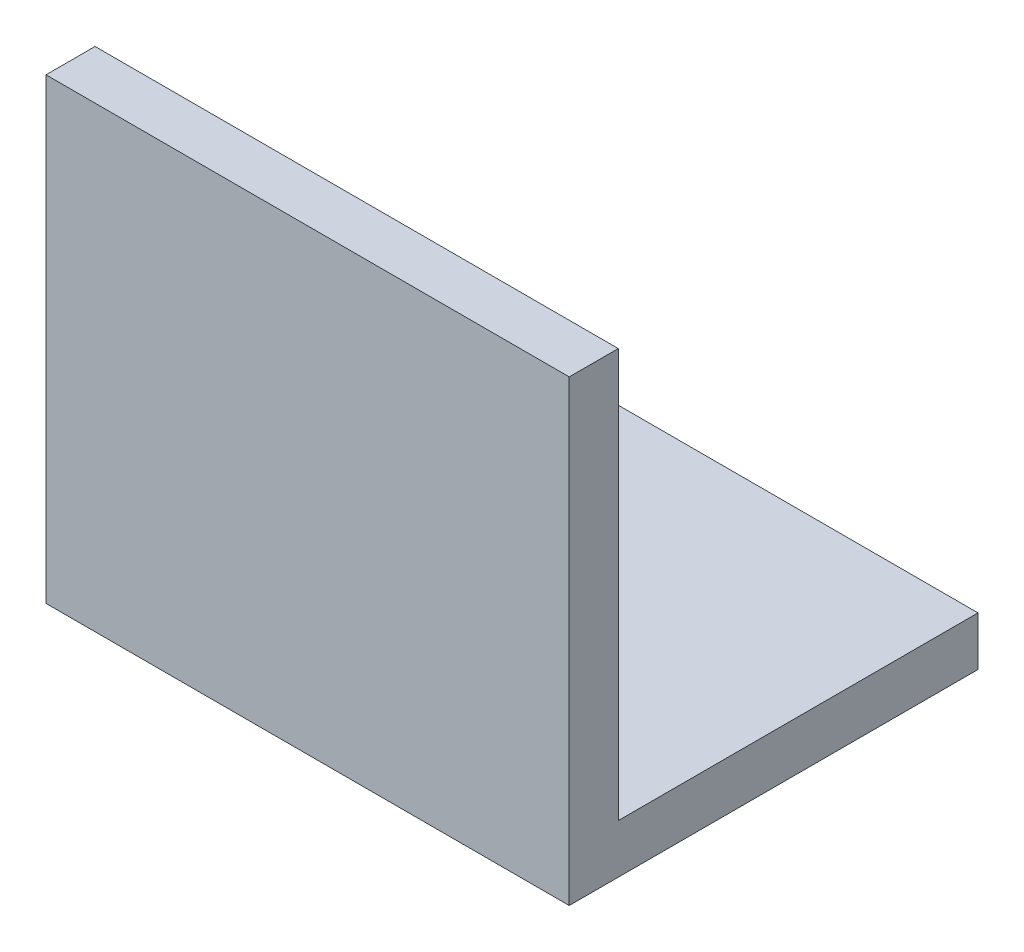
from build123d import *

# Parameters (mm, degrees)
CROQUIS1_W              = 16
CROQUIS1_H              = 14
SALIENTE_EXTRUIR1_DEPTH = 1.5
CROQUIS2_W              = 16
CROQUIS2_H              = 1.5
SALIENTE_EXTRUIR2_DEPTH = 11


with BuildPart() as part:
    # Croquis1 → Saliente-Extruir1 (new body)
    with BuildSketch(Plane.XY):
        Rectangle(CROQUIS1_W, CROQUIS1_H)
    extrude(amount=SALIENTE_EXTRUIR1_DEPTH)

    # Croquis2 → Saliente-Extruir2 (add)
    with BuildSketch(Plane(origin=(0, 0, 0), x_dir=(-1, 0, 0), z_dir=(0, 0, -1))):
        with Locations((0, -6.25)):
            Rectangle(CROQUIS2_W, CROQUIS2_H)
    extrude(amount=SALIENTE_EXTRUIR2_DEPTH)


solid = part.part
